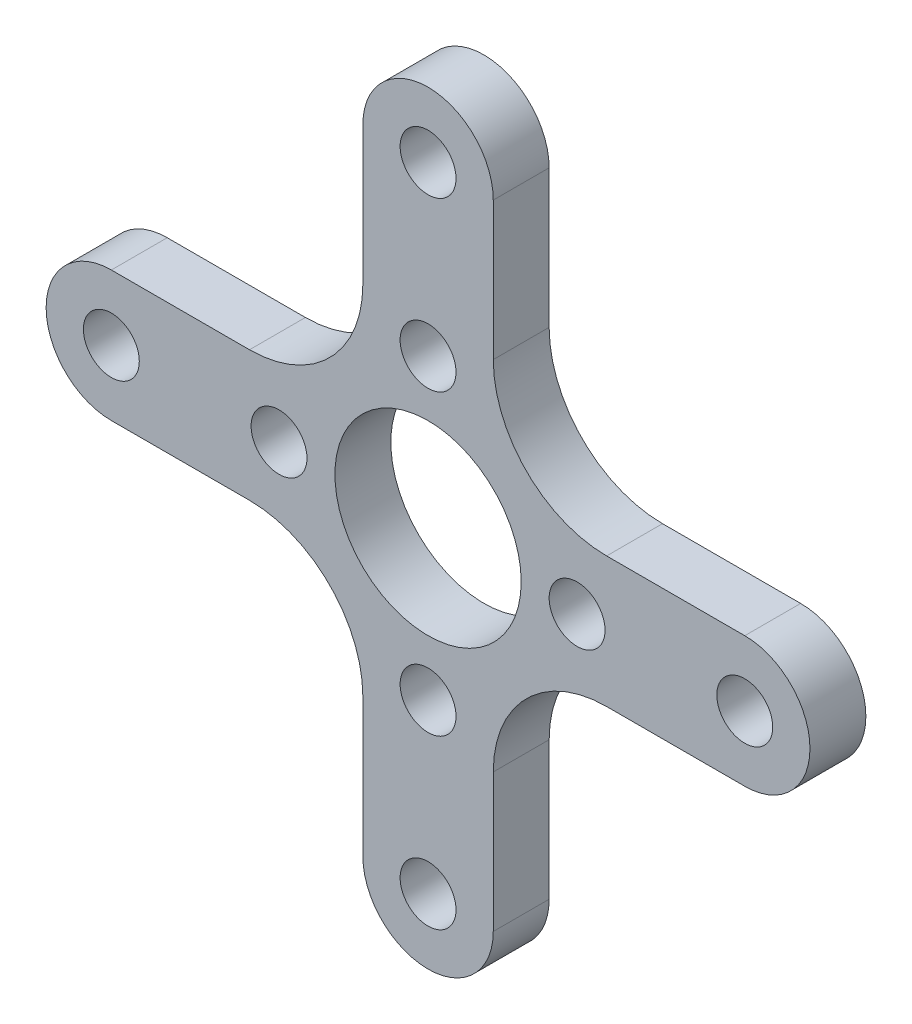
from build123d import *

# Parameters (mm, degrees)
SKETCH1_R           = 5
SKETCH1_R_2         = 1.5
BOSS_EXTRUDE1_DEPTH = 3
CUT_EXTRUDE1_START  = -3
SKETCH2_R           = 1.5
CUT_EXTRUDE1_DEPTH  = 3


with BuildPart() as part:
    # Sketch1 → Boss-Extrude1 (new body)
    with BuildSketch(Plane.XY):
        with BuildLine():
            Line((-3.5, 9.584427843), (-3.5, 17))
            ThreePointArc((-3.5, 17), (0, 20.5), (3.5, 17))
            Line((3.5, 17), (3.5, 9.584427843))
            ThreePointArc((3.5, 9.584427843), (5.282087655, 5.282087655), (9.584427843, 3.5))
            Line((9.584427843, 3.5), (17, 3.5))
            ThreePointArc((17, 3.5), (20.5, 0), (17, -3.5))
            Line((17, -3.5), (9.584427843, -3.5))
            ThreePointArc((9.584427843, -3.5), (5.282087655, -5.282087655), (3.5, -9.584427843))
            Line((3.5, -9.584427843), (3.5, -17))
            ThreePointArc((3.5, -17), (0, -20.5), (-3.5, -17))
            Line((-3.5, -17), (-3.5, -9.584427843))
            ThreePointArc((-3.5, -9.584427843), (-5.282087655, -5.282087655), (-9.584427843, -3.5))
            Line((-9.584427843, -3.5), (-17, -3.5))
            ThreePointArc((-17, -3.5), (-20.5, 0), (-17, 3.5))
            Line((-17, 3.5), (-9.584427843, 3.5))
            ThreePointArc((-9.584427843, 3.5), (-5.282087655, 5.282087655), (-3.5, 9.584427843))
        make_face()
        Circle(SKETCH1_R, mode=Mode.SUBTRACT)
        with Locations((8, 0)):
            Circle(SKETCH1_R_2, mode=Mode.SUBTRACT)
        with Locations((17, 0)):
            Circle(SKETCH1_R_2, mode=Mode.SUBTRACT)
    extrude(amount=BOSS_EXTRUDE1_DEPTH)

    # Sketch2 → Cut-Extrude1 (cut)
    with BuildSketch(Plane.XY.offset(3).offset(CUT_EXTRUDE1_START)):
        with Locations((17, 0)):
            Circle(SKETCH2_R)
        with Locations((8, 0)):
            Circle(SKETCH2_R)
        with Locations((0, -8)):
            Circle(SKETCH2_R)
        with Locations((0, -17)):
            Circle(SKETCH2_R)
        with Locations((-8, 0)):
            Circle(SKETCH2_R)
        with Locations((-17, 0)):
            Circle(SKETCH2_R)
        with Locations((0, 8)):
            Circle(SKETCH2_R)
        with Locations((0, 17)):
            Circle(SKETCH2_R)
    extrude(amount=CUT_EXTRUDE1_DEPTH, mode=Mode.SUBTRACT)


solid = part.part
